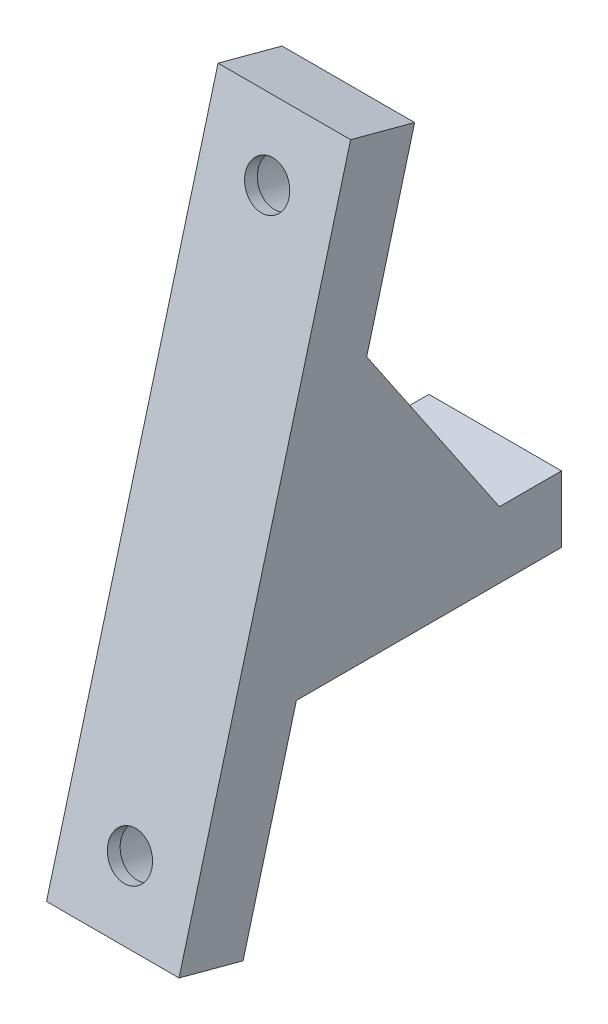
from build123d import *

# Parameters (mm, degrees)
EXTRUDE_2_DEPTH          = 10
SKETCH_3_R               = 1.65
CUT_EXTRUDE_2_DEPTH      = 10
CUT_EXTRUDE_3_DEPTH      = 10
CUT_EXTRUDE_3_DEPTH_BACK = 9
SKETCH_5_R               = 1.65
SKETCH_6_R               = 3
CUT_EXTRUDE_4_DEPTH      = 8
SKETCH_7_R               = 2.25
CUT_EXTRUDE_5_DEPTH      = 4


with BuildPart() as part:
    # 草图1 → 凸台-拉伸2 (new body)
    with BuildSketch(Plane(origin=(0, 0, 0), x_dir=(0, 0, -1), z_dir=(1, 0, 0))):
        Polygon((0, 0), (12.940952255, 48.296291314), (17.770581387, 47.002196089), (14.155128272, 33.509141372), (24.163916678, 18.705904774), (28.848867018, 18.705904774), (28.848867018, 13.705904774), (8.848867018, 13.705904774), (4.829629131, -1.294095226), align=None)
    extrude(amount=EXTRUDE_2_DEPTH)

    # 草图3 → 切除-拉伸2 (cut)
    with BuildSketch(Plane(origin=(0, -1.294095226, -4.829629131), x_dir=(-1, 0, 0), z_dir=(0, -0.2588190451025247, -0.9659258262890673))):
        with Locations(Location((-5, 45, 0), (0, 0, 90))):
            Circle(SKETCH_3_R)
        with Locations(Location((-5, 5, 0), (0, 0, 90))):
            Circle(SKETCH_3_R)
    extrude(amount=-CUT_EXTRUDE_2_DEPTH, mode=Mode.SUBTRACT)

    # 草图5 → 切除-拉伸3 (cut, two sides: drawn at the far end of the back side and taken through both)
    with BuildSketch(Plane(origin=(0, 18.705904774, 0), x_dir=(1, 0, 0), z_dir=(0, 1, 0)).offset(-CUT_EXTRUDE_3_DEPTH_BACK)):
        with Locations(Location((5, 23.848867018, 0), (0, 0, 90))):
            Circle(SKETCH_5_R)
    extrude(amount=CUT_EXTRUDE_3_DEPTH + CUT_EXTRUDE_3_DEPTH_BACK, mode=Mode.SUBTRACT)

    # 草图6 → 切除-拉伸4 (cut)
    with BuildSketch(Plane(origin=(0, 18.705904774, 0), x_dir=(1, 0, 0), z_dir=(0, 1, 0))):
        with Locations((5, 23.848867018)):
            Circle(SKETCH_6_R)
    extrude(amount=CUT_EXTRUDE_4_DEPTH, mode=Mode.SUBTRACT)

    # 草图7 → 切除-拉伸5 (cut)
    with BuildSketch(Plane(origin=(0, -1.294095226, -4.829629131), x_dir=(-1, 0, 0), z_dir=(0, -0.25881904510252446, -0.9659258262890674))):
        with Locations(Location((-5, 45, 0), (0, 0, 90))):
            Circle(SKETCH_7_R)
        with Locations(Location((-5, 5, 0), (0, 0, 90))):
            Circle(SKETCH_7_R)
    extrude(amount=-CUT_EXTRUDE_5_DEPTH, mode=Mode.SUBTRACT)


solid = part.part
